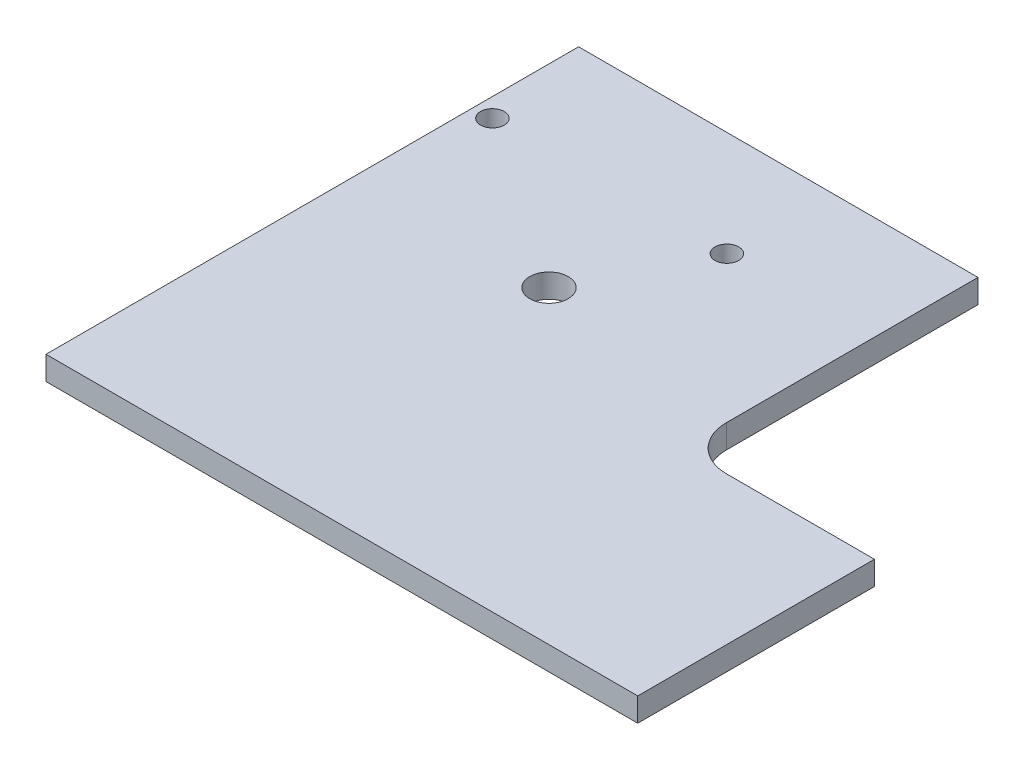
from build123d import *

# Parameters (mm, degrees)
BOSS_EXTRUDE1_DEPTH     = 1.6
FILLET1_R               = 3
M2_CLEARANCE_HOLE1_D    = 2.6
CUT_EXTRUDE1_DEPTH      = 38.159251876
CUT_EXTRUDE1_DEPTH_BACK = 38.159251876
SKETCH5_R               = 0.8
SKETCH6_R               = 3
CUT_EXTRUDE2_DEPTH      = 0.001


with BuildPart() as part:
    # Sketch1 → Boss-Extrude1 (new body)
    with BuildSketch(Plane(origin=(0, 0, 0), x_dir=(1, 0, 0), z_dir=(0, 1, 0))):
        Polygon((-13.5, -10), (-13.5, 10), (13.5, 10), (13.5, -10), (26.5, -10), (26.5, -26), (-13.5, -26), align=None)
    extrude(amount=BOSS_EXTRUDE1_DEPTH)

    # Fillet1
    fillet1_edges = [part.edges().sort_by_distance(p)[0] for p in [
        (13.5, 0.8, 10),
    ]]
    fillet(fillet1_edges, radius=FILLET1_R)

    # M2 Clearance Hole1 (through all)
    with Locations(Plane(origin=(0, 1.6, 0), x_dir=(1, 0, 0), z_dir=(0, 1, 0))):
        with Locations((-0.4, -5.1)):
            Hole(M2_CLEARANCE_HOLE1_D / 2)

    # Sketch5 → Cut-Extrude1 (cut, two sides: drawn at the far end of the back side and taken through both)
    with BuildSketch(Plane(origin=(0, 1.6, 0), x_dir=(1, 0, 0), z_dir=(0, 1, 0)).offset(-CUT_EXTRUDE1_DEPTH_BACK)):
        with Locations(Location((-12.225, 2.9, 0), (0, 0, 270))):
            Circle(SKETCH5_R)
        with Locations(Location((3.625, 2.9, 0), (0, 0, 270))):
            Circle(SKETCH5_R)
    extrude(amount=CUT_EXTRUDE1_DEPTH + CUT_EXTRUDE1_DEPTH_BACK, mode=Mode.SUBTRACT)

    # Sketch6 → Cut-Extrude2 (cut)
    with BuildSketch(Plane.XZ):
        with Locations(Location((-0.4, 5.1, 0), (0, 0, 270))):
            Circle(SKETCH6_R)
    extrude(amount=-CUT_EXTRUDE2_DEPTH, mode=Mode.SUBTRACT)


solid = part.part
